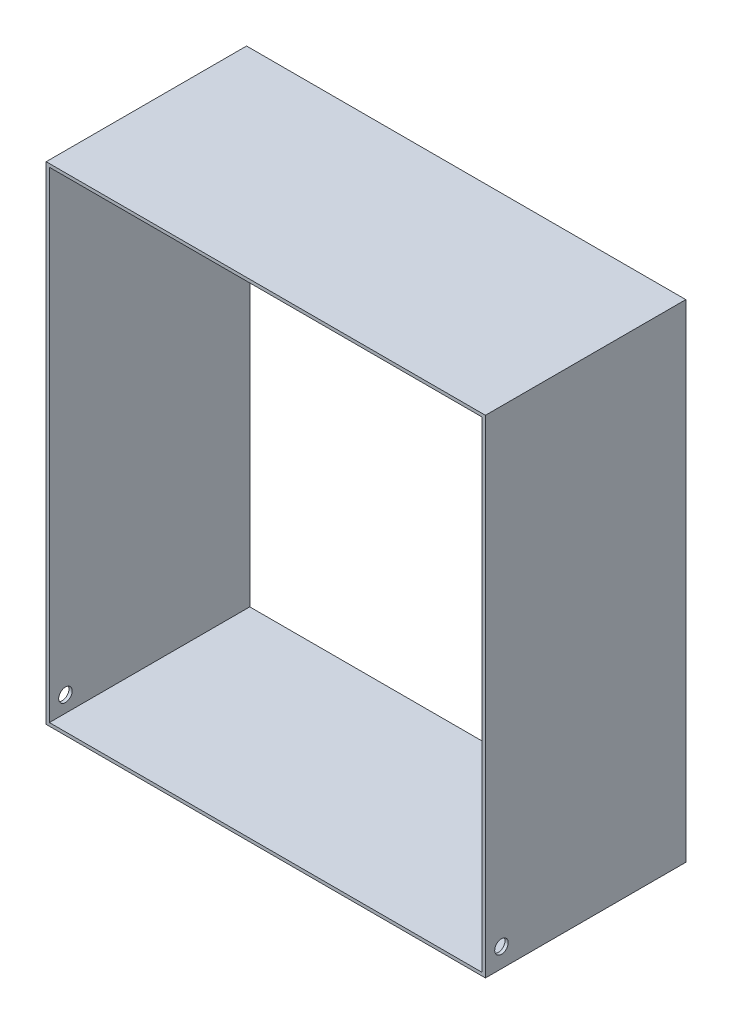
from build123d import *

# Parameters (mm, degrees)
SKETCH1_W           = 270
SKETCH1_H           = 300
BOSS_EXTRUDE1_DEPTH = 125
SKETCH5_R           = 4.2
CUT_EXTRUDE1_DEPTH  = 299


with BuildPart() as part:
    # Sketch1 → Boss-Extrude1 (new body)
    with BuildSketch(Plane.XY):
        Polygon((270, 302), (272, 302), (272, 300), (272, 0), (272, -2), (270, -2), (0, -2), (-2, -2), (-2, 0), (-2, 300), (-2, 302), (0, 302), align=None)
        with Locations((135, 150)):
            Rectangle(SKETCH1_W, SKETCH1_H, mode=Mode.SUBTRACT)
    extrude(amount=-BOSS_EXTRUDE1_DEPTH)

    # Sketch5 → Cut-Extrude1 (cut)
    with BuildSketch(Plane(origin=(272, 0, 0), x_dir=(0, 0, -1), z_dir=(1, 0, 0))):
        with Locations((10, 10)):
            Circle(SKETCH5_R)
    extrude(amount=-CUT_EXTRUDE1_DEPTH, mode=Mode.SUBTRACT)


solid = part.part
